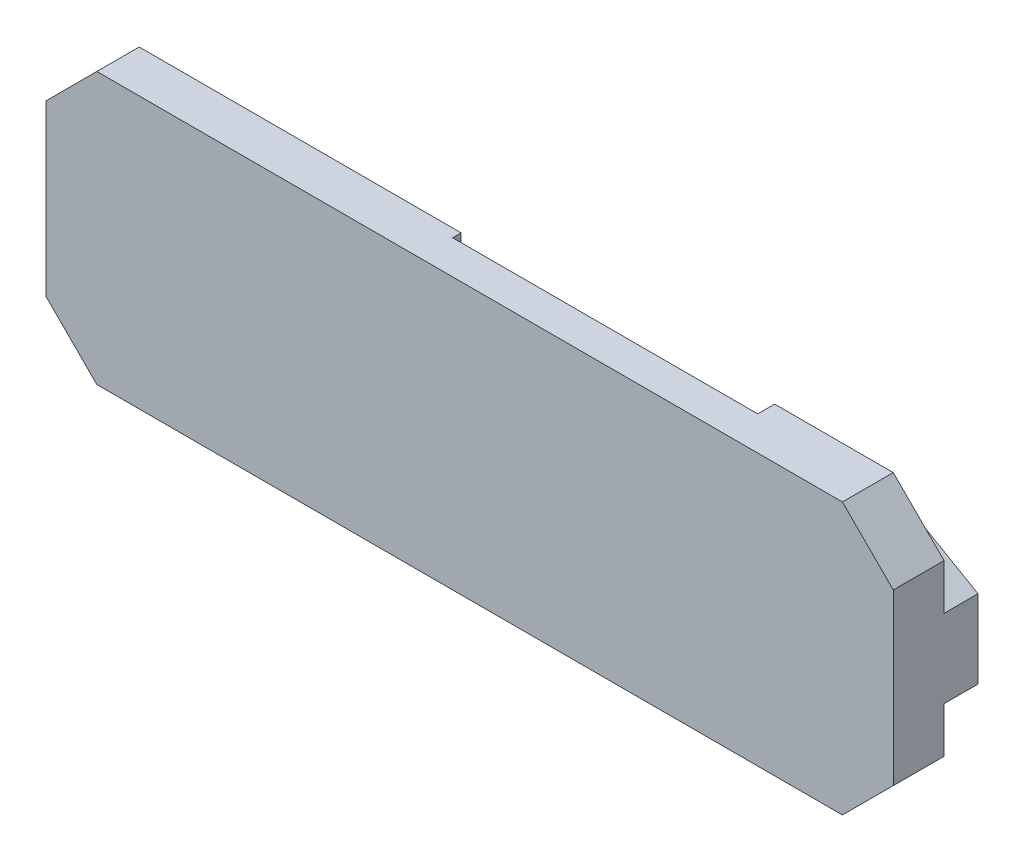
from build123d import *

# Parameters (mm, degrees)
EXTRUDE_1_DEPTH = 2
EXTRUDE_3_DEPTH = 0.5
FILLET_1_R      = 1
EXTRUDE_4_DEPTH = 1
EXTRUDE_5_DEPTH = 2


with BuildPart() as part:
    # 스케치1 → 보스-돌출1 (new body)
    with BuildSketch(Plane.XY):
        Polygon((3, 16), (0, 13), (0, 3), (3, 0), (47, 0), (50, 3), (50, 13), (47, 16), align=None)
    extrude(amount=EXTRUDE_1_DEPTH)

    # 스케치3 → 보스-돌출3 (add)
    with BuildSketch(Plane(origin=(0, 0, 0), x_dir=(-1, 0, 0), z_dir=(0, 0, -1))):
        Polygon((0, 13), (-3, 16), (-22, 16), (-22, 0), (-3, 0), (0, 3), align=None)
    extrude(amount=EXTRUDE_3_DEPTH)

    # 필렛1
    fillet_1_edges = [part.edges().sort_by_distance(p)[0] for p in [
        (0, 8, -0.5),
    ]]
    fillet(fillet_1_edges, radius=FILLET_1_R)

    # 스케치2 → 보스-돌출4 (add)
    with BuildSketch(Plane(origin=(0, 0, 0), x_dir=(-1, 0, 0), z_dir=(0, 0, -1))):
        Polygon((-47, 0), (-40, 0), (-40, 16), (-47, 16), (-50, 13), (-50, 3), align=None)
    extrude(amount=EXTRUDE_4_DEPTH)

    # 스케치4 → 보스-돌출5 (add)
    with BuildSketch(Plane(origin=(0, 0, -1), x_dir=(-1, 0, 0), z_dir=(0, 0, -1))):
        Polygon((-46, 12.618802154), (-50, 10.309401077), (-50, 5.690598923), (-46, 3.381197846), (-42, 5.690598923), (-42, 10.309401077), align=None)
    extrude(amount=EXTRUDE_5_DEPTH)


solid = part.part
